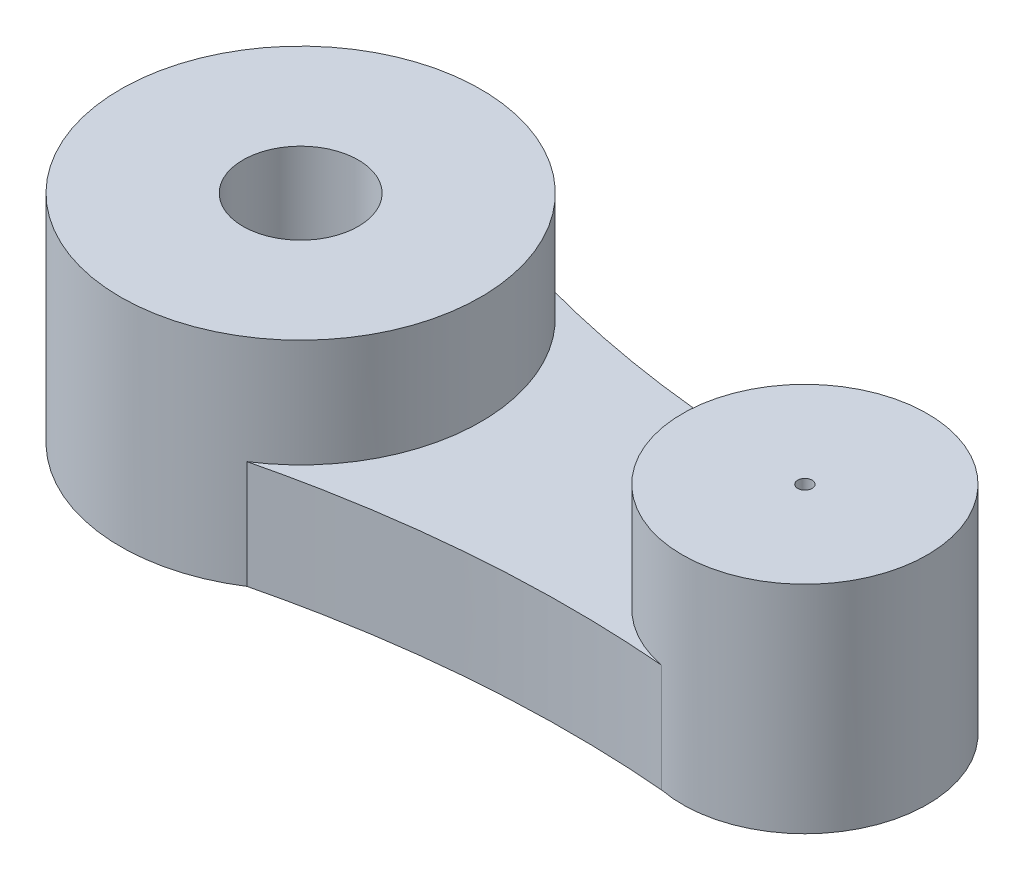
from build123d import *

# Parameters (mm, degrees)
SZKIC1_R                    = 12.5
DODANIE_WYCI_GNI_CIE2_DEPTH = 15
SZKIC3_R                    = 8.5
DODANIE_WYCI_GNI_CIE3_DEPTH = 15
DODANIE_WYCI_GNI_CIE4_DEPTH = 7.5
OTWORY_USTALAJ_CE_8_0MM1_D  = 8
SZKIC7_R                    = 0.5
WYTNIJ_WYCI_GNI_CIE1_DEPTH  = 15


with BuildPart() as part:
    # Szkic1 → Dodanie-wyciągnięcie2 (new body)
    with BuildSketch(Plane(origin=(0, 0, 0), x_dir=(1, 0, 0), z_dir=(0, 1, 0))):
        Circle(SZKIC1_R)
    extrude(amount=DODANIE_WYCI_GNI_CIE2_DEPTH)



with BuildPart() as body_2:
    # Szkic3 → Dodanie-wyciągnięcie3 (new body)
    with BuildSketch(Plane(origin=(0, 0, 0), x_dir=(1, 0, 0), z_dir=(0, 1, 0))):
        with Locations((35, 0)):
            Circle(SZKIC3_R)
    extrude(amount=DODANIE_WYCI_GNI_CIE3_DEPTH)


with BuildPart() as part_1:
    add(part.part)

    add(body_2.part)  # Dodanie-wyciągnięcie4 merges body 2
    # Szkic4 → Dodanie-wyciągnięcie4 (add)
    with BuildSketch(Plane(origin=(0, 0, 0), x_dir=(-1, 0, 0), z_dir=(0, -1, 0))):
        with BuildLine():
            ThreePointArc((-6.778939078, 10.502189533), (-12.5, 0), (-6.778939078, -10.502189533))
            add(Edge.make_bspline(
                [(-6.778939078, -10.502189533), (-20.225507154, -7.239536671), (-33.411274741, -8.350206707)],
                knots=[0, 0, 0, 0.631379274, 0.631379274, 0.631379274], degree=2))
            ThreePointArc((-33.411274741, -8.350206707), (-26.503236916, -0.234557237), (-32.953022418, 8.249841379))
            add(Edge.make_bspline(
                [(-6.778939078, 10.502189533), (-20.078070114, 6.877362512), (-32.953022418, 8.249841379)],
                knots=[0, 0, 0, 0.617827196, 0.617827196, 0.617827196], degree=2))
        make_face()
    extrude(amount=-DODANIE_WYCI_GNI_CIE4_DEPTH)

    # Otwory ustalające Ø8.0mm1 (through all)
    with Locations(Plane(origin=(0, 15, 0), x_dir=(1, 0, 0), z_dir=(0, 1, 0))):
        with Locations((0, 0)):
            Hole(OTWORY_USTALAJ_CE_8_0MM1_D / 2)

    # Szkic7 → Wytnij-wyciągnięcie1 (cut)
    with BuildSketch(Plane(origin=(0, 15, 0), x_dir=(1, 0, 0), z_dir=(0, 1, 0))):
        with Locations((35, 0)):
            Circle(SZKIC7_R)
    extrude(amount=-WYTNIJ_WYCI_GNI_CIE1_DEPTH, mode=Mode.SUBTRACT)


solid = part_1.part
